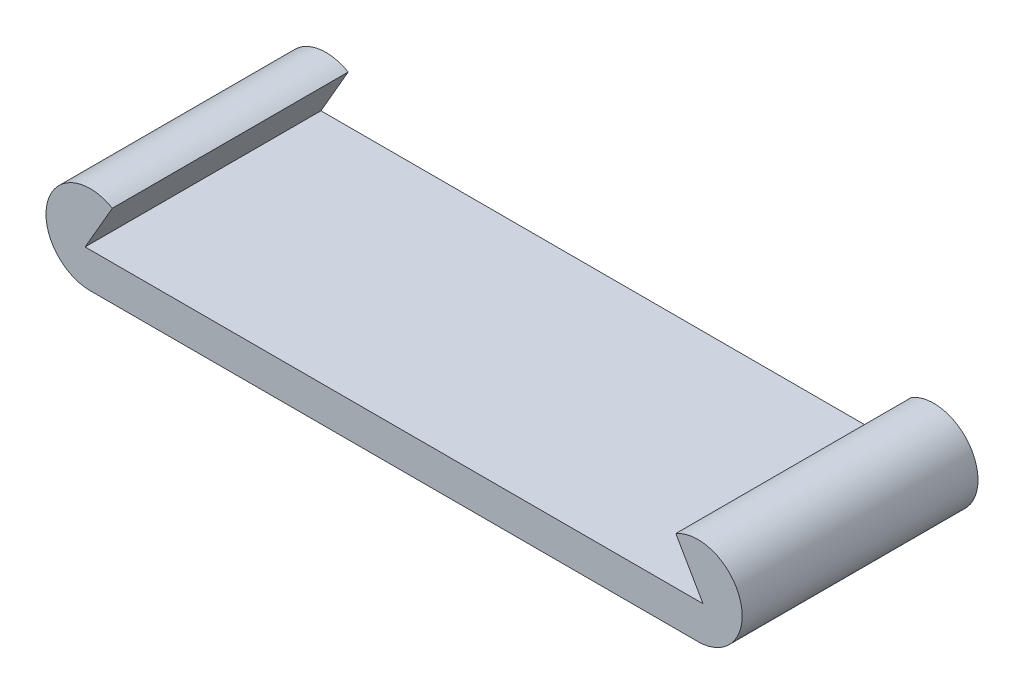
from build123d import *

# Parameters (mm, degrees)
BOSS_EXTRUDE1_DEPTH = 10


with BuildPart() as part:
    # Sketch1 → Boss-Extrude1 (new body)
    with BuildSketch(Plane.XY):
        with BuildLine():
            Line((13.1, 1.5), (11.945299462, 3.5))
            ThreePointArc((11.945299462, 3.5), (14.694854951, 2.361096826), (12.883121635, 0))
            Line((12.883121635, 0), (-12.883121635, 0))
            ThreePointArc((-12.883121635, 0), (-14.694854951, 2.361096826), (-11.945299462, 3.5))
            Line((-11.945299462, 3.5), (-13.1, 1.5))
            Line((-13.1, 1.5), (13.1, 1.5))
        make_face()
    extrude(amount=BOSS_EXTRUDE1_DEPTH)


solid = part.part
